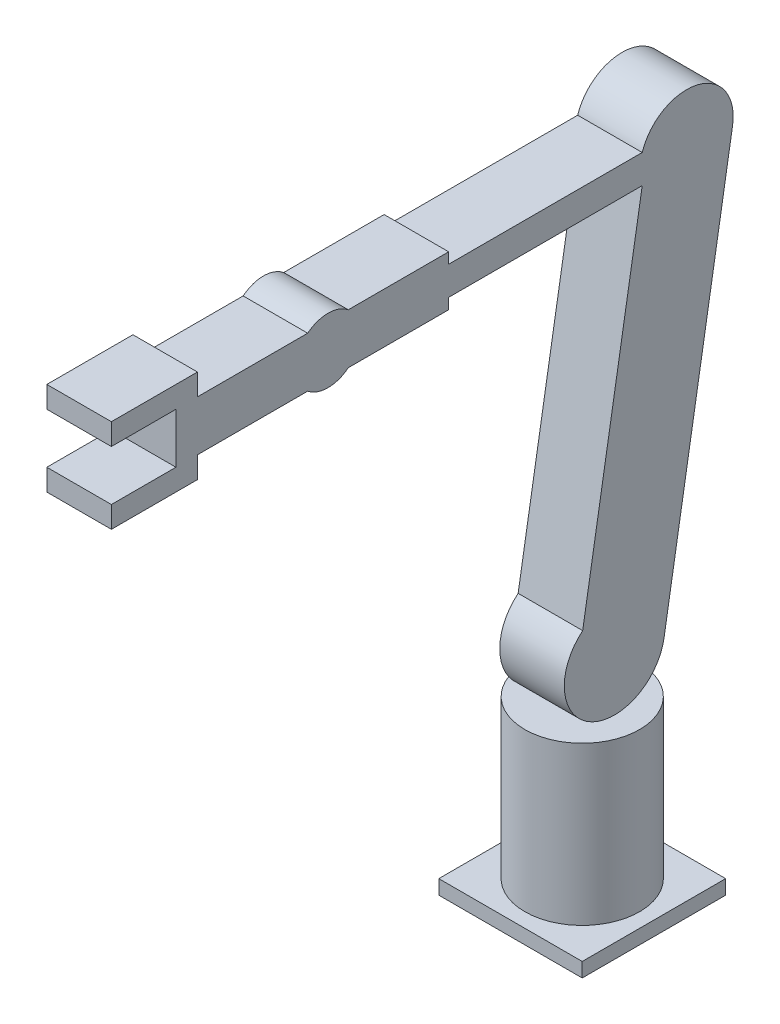
from build123d import *

# Parameters (mm, degrees)
SKETCH1_R           = 40
BOSS_EXTRUDE1_DEPTH = 110
SKETCH2_W           = 100
SKETCH2_H           = 100
BOSS_EXTRUDE2_DEPTH = 10
BOSS_EXTRUDE3_DEPTH = 22.5


with BuildPart() as part:
    # Sketch1 → Boss-Extrude1 (new body)
    with BuildSketch(Plane(origin=(0, 0, 0), x_dir=(1, 0, 0), z_dir=(0, 1, 0))):
        with Locations(Location((0, 0, 0), (0, 0, 270))):
            Circle(SKETCH1_R)
    extrude(amount=BOSS_EXTRUDE1_DEPTH)

    # Sketch2 → Boss-Extrude2 (add)
    with BuildSketch(Plane.XZ):
        Rectangle(SKETCH2_W, SKETCH2_H)
    extrude(amount=BOSS_EXTRUDE2_DEPTH)


with BuildPart() as body_2:
    # Sketch3 → Boss-Extrude3 (new, symmetric)
    with BuildSketch(Plane(origin=(0, 0, 0), x_dir=(0, 0, -1), z_dir=(1, 0, 0))):
        with BuildLine():
            ThreePointArc((-22.181090039, 172.073958792), (-17.54707199, 114.716336672), (34.5194883, 139.220300396))
            Line((34.5194883, 139.220300396), (82.307000066, 424.633136082))
            ThreePointArc((82.307000066, 424.633136082), (57.957386061, 461.5736497), (19.32989731, 440))
            Line((19.32989731, 440), (-115.604674874, 440))
            Line((-115.604674874, 440), (-115.604674874, 447.5))
            Line((-115.604674874, 447.5), (-185.604674874, 447.5))
            ThreePointArc((-185.604674874, 447.5), (-199.746810498, 452.5), (-213.888946122, 447.5))
            Line((-213.888946122, 447.5), (-290.746810498, 447.5))
            Line((-290.746810498, 447.5), (-290.746810498, 462.5))
            Line((-290.746810498, 462.5), (-350.746810498, 462.5))
            Line((-350.746810498, 462.5), (-350.746810498, 447.5))
            Line((-350.746810498, 447.5), (-305.746810498, 447.5))
            Line((-305.746810498, 447.5), (-305.746810498, 412.5))
            Line((-305.746810498, 412.5), (-350.746810498, 412.5))
            Line((-350.746810498, 412.5), (-350.746810498, 397.5))
            Line((-350.746810498, 397.5), (-290.746810498, 397.5))
            Line((-290.746810498, 397.5), (-290.746810498, 412.5))
            Line((-290.746810498, 412.5), (-213.888946122, 412.5))
            ThreePointArc((-213.888946122, 412.5), (-199.746810498, 407.5), (-185.604674874, 412.5))
            Line((-185.604674874, 412.5), (-115.604674874, 412.5))
            Line((-115.604674874, 412.5), (-115.604674874, 420))
            Line((-115.604674874, 420), (19.32989731, 420))
            Line((19.32989731, 420), (-22.181090039, 172.073958792))
        make_face()
    extrude(amount=BOSS_EXTRUDE3_DEPTH, both=True)


solid = Compound([part.part, body_2.part])
